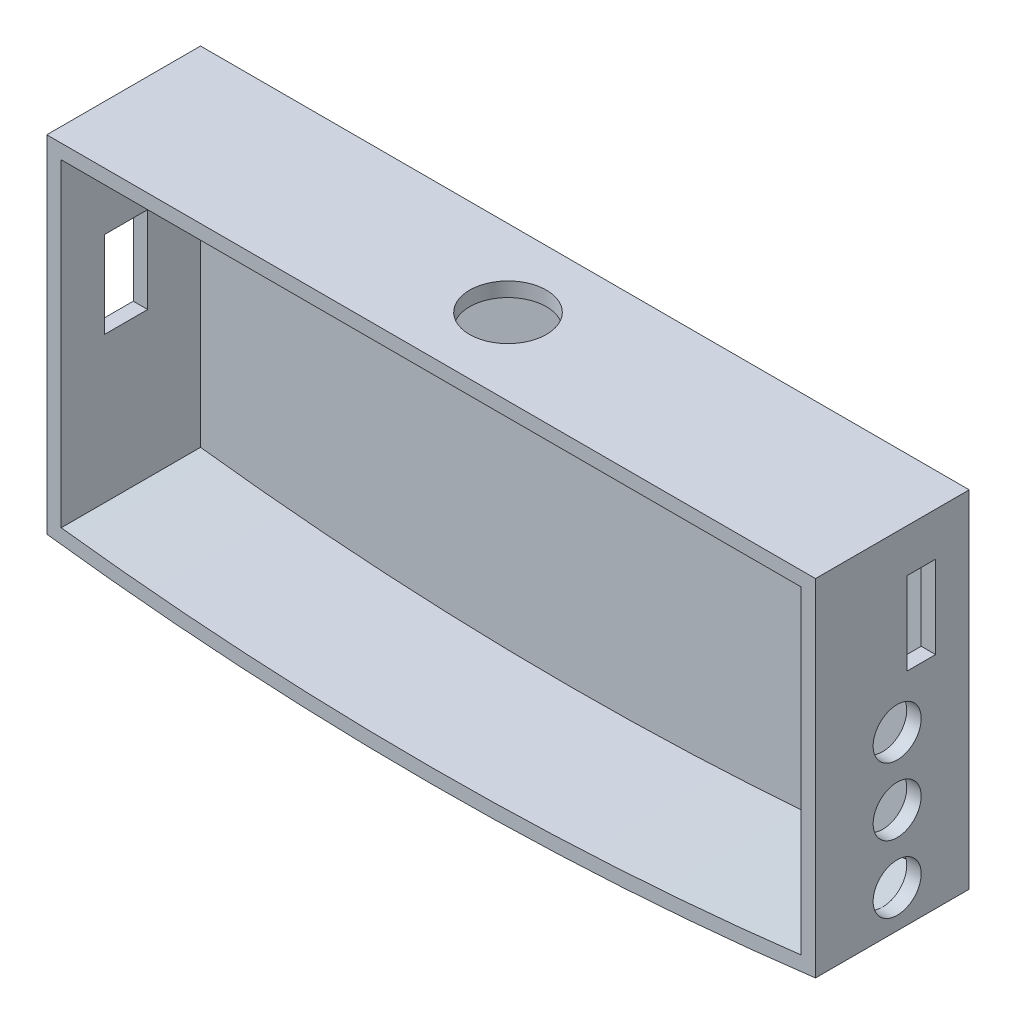
from build123d import *

# Parameters (mm, degrees)
SKETCH_1_W          = 80
SKETCH_1_H          = 36
EXTRUDE_1_DEPTH     = 16
SHELL_1_T           = -1.5
CUT_EXTRUDE_3_REACH = 89.695
SKETCH_2_W          = 4.5
SKETCH_2_H          = 9
CUT_EXTRUDE_4_REACH = 89.695
SKETCH_6_R          = 2.5
SKETCH_6_W          = 3
SKETCH_6_H          = 8.6
SKETCH_7_R          = 4
CUT_EXTRUDE_5_DEPTH = 2


with BuildPart() as part:
    # 草图1 → 凸台-拉伸1 (new body)
    with BuildSketch(Plane.XY):
        with Locations((-50.420566467, -11.667328482)):
            Rectangle(SKETCH_1_W, SKETCH_1_H)
        with BuildLine():
            Line((-10.420566467, -29.667328482), (-90.420566467, -29.667328482))
            ThreePointArc((-90.420566467, -29.667328482), (-50.420566467, -32.163413079), (-10.420566467, -29.667328482))
        make_face()
    extrude(amount=EXTRUDE_1_DEPTH)

    # 抽壳1
    shell_1_openings = [part.faces().sort_by_distance(p)[0] for p in [
        (-50.420566467, -12.507347913, 16),
    ]]
    offset(amount=SHELL_1_T, openings=shell_1_openings, kind=Kind.INTERSECTION)

    # 草图2 → 切除-拉伸3 (cut, up to next)
    with BuildSketch(Plane.ZY.offset(90.420566467), mode=Mode.PRIVATE) as cut_extrude_3_sk1:
        with Locations((9.25, -8.667328482)):
            Rectangle(SKETCH_2_W, SKETCH_2_H)
    cut_extrude_3_tool1 = extrude(cut_extrude_3_sk1.sketch, amount=-CUT_EXTRUDE_3_REACH, mode=Mode.PRIVATE) & part.part
    add(cut_extrude_3_tool1.solids().sort_by_distance((-90.420566, -8.667328, 9.25))[0], mode=Mode.SUBTRACT)

    # 草图6 → 切除-拉伸4 (cut, up to next)
    with BuildSketch(Plane(origin=(-10.420566467, 0, 0), x_dir=(0, 0, -1), z_dir=(1, 0, 0)), mode=Mode.PRIVATE) as cut_extrude_4_sk1:
        with Locations((-7.5, -11.767328482)):
            Circle(SKETCH_6_R)
    cut_extrude_4_tool1 = extrude(cut_extrude_4_sk1.sketch, amount=-CUT_EXTRUDE_4_REACH, mode=Mode.PRIVATE) & part.part
    # 草图6 → 切除-拉伸4 (cut, up to next)
    with BuildSketch(Plane(origin=(-10.420566467, 0, 0), x_dir=(0, 0, -1), z_dir=(1, 0, 0)), mode=Mode.PRIVATE) as cut_extrude_4_sk2:
        with Locations((-7.5, -18.767328482)):
            Circle(SKETCH_6_R)
    cut_extrude_4_tool2 = extrude(cut_extrude_4_sk2.sketch, amount=-CUT_EXTRUDE_4_REACH, mode=Mode.PRIVATE) & part.part
    # 草图6 → 切除-拉伸4 (cut, up to next)
    with BuildSketch(Plane(origin=(-10.420566467, 0, 0), x_dir=(0, 0, -1), z_dir=(1, 0, 0)), mode=Mode.PRIVATE) as cut_extrude_4_sk3:
        with Locations((-7.5, -25.767328482)):
            Circle(SKETCH_6_R)
    cut_extrude_4_tool3 = extrude(cut_extrude_4_sk3.sketch, amount=-CUT_EXTRUDE_4_REACH, mode=Mode.PRIVATE) & part.part
    # 草图6 → 切除-拉伸4 (cut, up to next)
    with BuildSketch(Plane(origin=(-10.420566467, 0, 0), x_dir=(0, 0, -1), z_dir=(1, 0, 0)), mode=Mode.PRIVATE) as cut_extrude_4_sk4:
        with Locations((-5, -2.467328482)):
            Rectangle(SKETCH_6_W, SKETCH_6_H)
    cut_extrude_4_tool4 = extrude(cut_extrude_4_sk4.sketch, amount=-CUT_EXTRUDE_4_REACH, mode=Mode.PRIVATE) & part.part
    add(cut_extrude_4_tool1.solids().sort_by_distance((-10.420566, -11.767328, 7.5))[0], mode=Mode.SUBTRACT)
    add(cut_extrude_4_tool2.solids().sort_by_distance((-10.420566, -18.767328, 7.5))[0], mode=Mode.SUBTRACT)
    add(cut_extrude_4_tool3.solids().sort_by_distance((-10.420566, -25.767328, 7.5))[0], mode=Mode.SUBTRACT)
    add(cut_extrude_4_tool4.solids().sort_by_distance((-10.420566, -2.467328, 5))[0], mode=Mode.SUBTRACT)

    # 草图7 → 切除-拉伸5 (cut)
    with BuildSketch(Plane(origin=(0, 6.332671518, 0), x_dir=(1, 0, 0), z_dir=(0, 1, 0))):
        with Locations(Location((-50.420566467, -8, 0), (0, 0, 270))):
            Circle(SKETCH_7_R)
    extrude(amount=-CUT_EXTRUDE_5_DEPTH, mode=Mode.SUBTRACT)


solid = part.part
